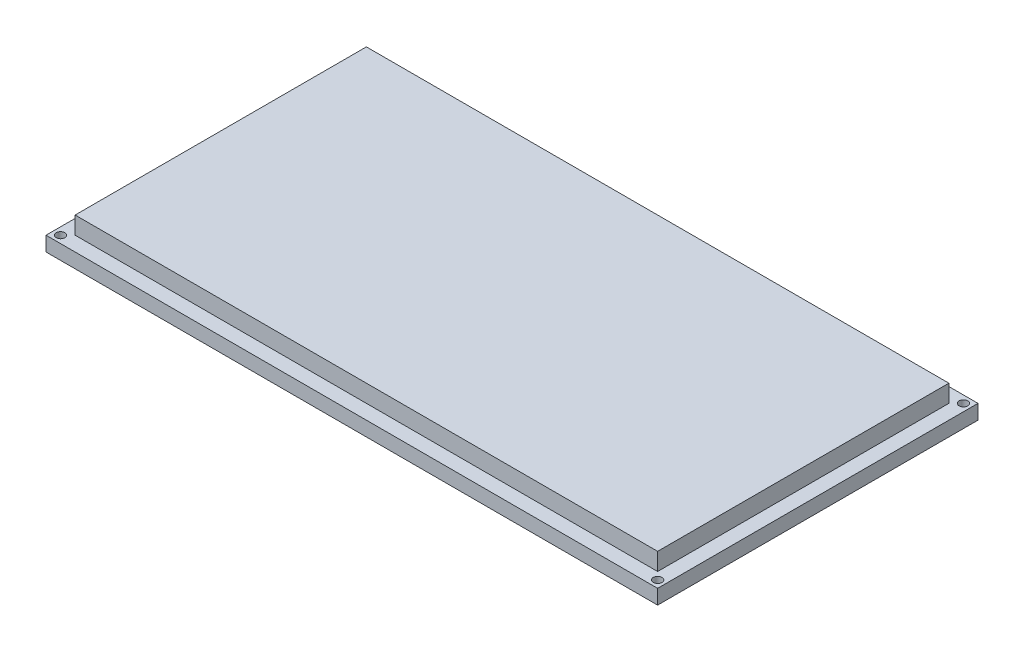
from build123d import *

# Parameters (mm, degrees)
SKETCH1_W               = 210
SKETCH1_H               = 110
TOP_DEPTH               = 5
SKETCH2_W               = 200
SKETCH2_H               = 100
BOTTOM_DEPTH            = 6
HOLE_REACH              = 120.684
SKETCH4_R               = 1.5
HOLE_PATTERN_COUNT      = 2
HOLE_PATTERN_PITCH      = 105
HOLE_PATTERN_COUNT_DIR2 = 2
HOLE_PATTERN_PITCH_DIR2 = 205


with BuildPart() as part:
    # Sketch1 → Top (new body)
    with BuildSketch(Plane(origin=(0, 0, 0), x_dir=(1, 0, 0), z_dir=(0, 1, 0))):
        Rectangle(SKETCH1_W, SKETCH1_H)
    extrude(amount=TOP_DEPTH)

    # Sketch2 → Bottom (add)
    with BuildSketch(Plane(origin=(0, 5, 0), x_dir=(1, 0, 0), z_dir=(0, 1, 0))):
        Rectangle(SKETCH2_W, SKETCH2_H)
    extrude(amount=BOTTOM_DEPTH)

    # Sketch4 → Hole (cut, up to next)
    with BuildSketch(Plane(origin=(0, 5, 0), x_dir=(1, 0, 0), z_dir=(0, 1, 0)), mode=Mode.PRIVATE) as hole_sk1:
        with Locations(Location((-102.5, -52.5, 0), (0, 0, 270))):
            Circle(SKETCH4_R)
    hole_tool1 = extrude(hole_sk1.sketch, amount=-HOLE_REACH, mode=Mode.PRIVATE) & part.part
    hole = hole_tool1.solids().sort_by_distance((-102.5, 5, 52.5))[0]
    add(hole, mode=Mode.SUBTRACT)

    # Hole-Pattern: Hole 2 × 2
    with Locations(*[(j * HOLE_PATTERN_PITCH_DIR2, 0, -i * HOLE_PATTERN_PITCH) for i in range(HOLE_PATTERN_COUNT) for j in range(HOLE_PATTERN_COUNT_DIR2) if (i, j) != (0, 0)]):
        add(hole, mode=Mode.SUBTRACT)


solid = part.part
